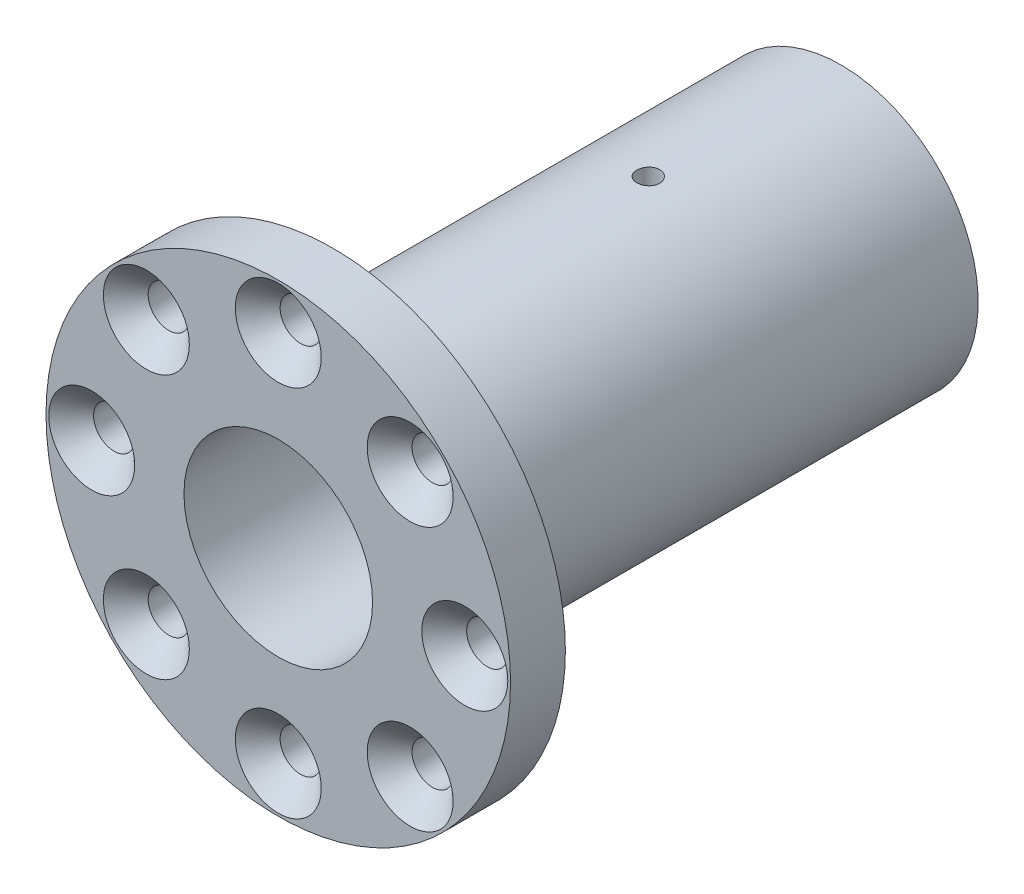
from build123d import *

# Parameters (mm, degrees)
SKETCH1_W                                         = 25.4
SKETCH1_H                                         = 6
SKETCH2_R                                         = 15
BOSS_EXTRUDE1_DEPTH                               = 55.54
CUT_EXTRUDE1_DEPTH                                = 72.256519702
SKETCH4_W                                         = 7.0104
SKETCH4_H                                         = 61.54
F_2_CLEARANCE_HOLE1_D                             = 2.5
F_2_CLEARANCE_HOLE1_DEPTH                         = 12
SKETCH7_W                                         = 1.25
SKETCH7_H                                         = 16.341500105
CSK_FOR_8_FLAT_HEAD_MACHINE_SCREW_100_D           = 4.5
CSK_FOR_8_FLAT_HEAD_MACHINE_SCREW_100_DEPTH       = 61.54
CSK_FOR_8_FLAT_HEAD_MACHINE_SCREW_100_CSINK_D     = 9.4
CSK_FOR_8_FLAT_HEAD_MACHINE_SCREW_100_CSINK_ANGLE = 90
SKETCH11_R                                        = 10.3124
CUT_EXTRUDE2_DEPTH                                = 38.1


with BuildPart() as part:
    # Sketch1 → Revolve1 (revolve)
    with BuildSketch(Plane.XZ, mode=Mode.PRIVATE) as revolve1_sk:
        with Locations((12.7, 58.54)):
            Rectangle(SKETCH1_W, SKETCH1_H)
    revolve(revolve1_sk.sketch.rotate(Axis((0, 0, 61.54), (0, 0, -1)), 180), axis=Axis((0, 0, 61.54), (0, 0, -1)))

    # Sketch2 → Boss-Extrude1 (add)
    with BuildSketch(Plane(origin=(0, 0, 55.54), x_dir=(-1, 0, 0), z_dir=(0, 0, -1))):
        Circle(SKETCH2_R)
    extrude(amount=BOSS_EXTRUDE1_DEPTH)

    # Sketch3 → Cut-Extrude1 (cut, through all)
    with BuildSketch(Plane(origin=(0, 0, 0), x_dir=(-1, 0, 0), z_dir=(0, 0, -1))):
        with BuildLine():
            Line((2.5, 9.058499895), (-2.5, 9.058499895))
            Line((-2.5, 9.058499895), (-2.5, 6.538348415))
            ThreePointArc((-2.5, 6.538348415), (0, 7), (2.5, 6.538348415))
            Line((2.5, 6.538348415), (2.5, 9.058499895))
        make_face()
    extrude(amount=-CUT_EXTRUDE1_DEPTH, mode=Mode.SUBTRACT)

    # Sketch4 → Cut-Revolve1 (revolve, cut)
    with BuildSketch(Plane.XZ):
        with Locations((3.5052, 30.77)):
            Rectangle(SKETCH4_W, SKETCH4_H)
    revolve(axis=Axis((0, 0, 61.54), (0, 0, -1)), mode=Mode.SUBTRACT)

    # #2 Clearance Hole1
    with Locations(Plane(origin=(0, 0, 0), x_dir=(-1, 0, 0), z_dir=(0, 0, -1))):
        with Locations((-11.5, 0), (-5.75, -9.959292144), (5.75, -9.959292144), (11.5, 0), (5.75, 9.959292144), (-5.75, 9.959292144)):
            Hole(F_2_CLEARANCE_HOLE1_D / 2, depth=F_2_CLEARANCE_HOLE1_DEPTH)

    # Sketch7 → #2 Clearance Hole2 (revolve, cut)
    with BuildSketch(Plane(origin=(0, 9.058499895, 21.082), x_dir=(0, 0, -1), z_dir=(1, 0, 0))):
        with Locations((0.625, 8.170750053)):
            Rectangle(SKETCH7_W, SKETCH7_H)
    revolve(axis=Axis((0, 2.708499895, 21.082), (0, 1, 0)), mode=Mode.SUBTRACT)

    # CSK for #8 Flat Head Machine Screw (100)1
    with Locations(Plane.XY.offset(61.54)):
        with Locations((0, 20.4), (14.424978336, 14.424978336), (20.4, 0), (14.424978336, -14.424978336), (0, -20.4), (-14.424978336, -14.424978336), (-20.4, 0), (-14.424978336, 14.424978336)):
            CounterSinkHole(CSK_FOR_8_FLAT_HEAD_MACHINE_SCREW_100_D / 2, CSK_FOR_8_FLAT_HEAD_MACHINE_SCREW_100_CSINK_D / 2, depth=CSK_FOR_8_FLAT_HEAD_MACHINE_SCREW_100_DEPTH, counter_sink_angle=CSK_FOR_8_FLAT_HEAD_MACHINE_SCREW_100_CSINK_ANGLE)

    # Sketch11 → Cut-Extrude2 (cut)
    with BuildSketch(Plane.XY.offset(61.54)):
        Circle(SKETCH11_R)
    extrude(amount=-CUT_EXTRUDE2_DEPTH, mode=Mode.SUBTRACT)


solid = part.part
